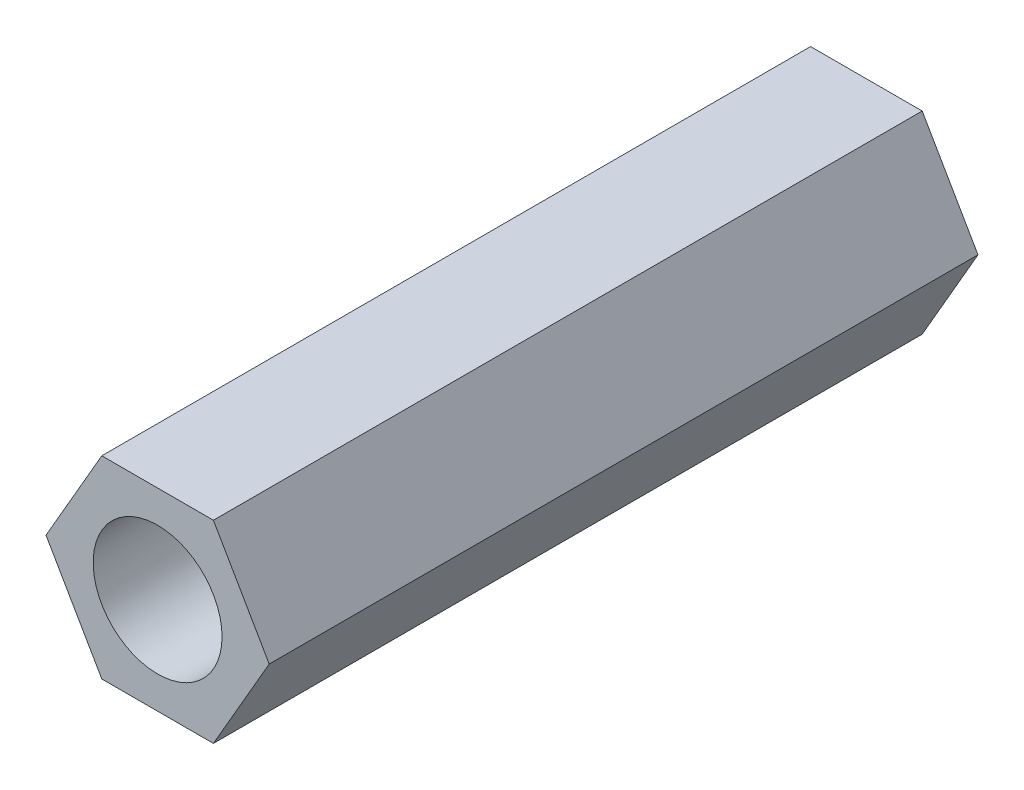
from build123d import *

# Parameters (mm, degrees)
ESQUISSE1_R        = 2
BOSS_EXTRU_1_DEPTH = 22


with BuildPart() as part:
    # Esquisse1 → Boss.-Extru.1 (new body)
    with BuildSketch(Plane.XY):
        Polygon((-3.464101615, 0), (-1.732050808, -3), (1.732050808, -3), (3.464101615, 0), (1.732050808, 3), (-1.732050808, 3), align=None)
        Circle(ESQUISSE1_R, mode=Mode.SUBTRACT)
    extrude(amount=BOSS_EXTRU_1_DEPTH)


solid = part.part
